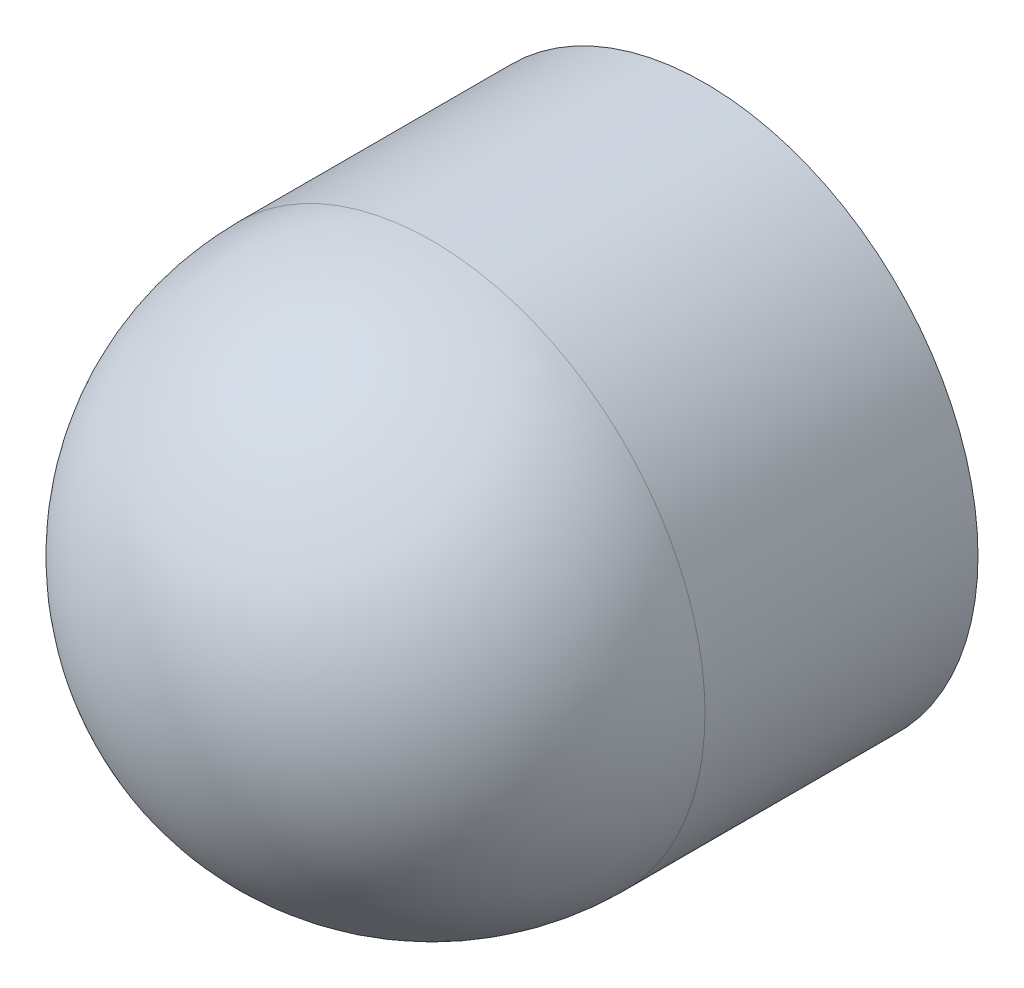
from build123d import *

# Parameters (mm, degrees)
ESQUISSE1_R             = 10
BOSS_EXTRU_1_DEPTH      = 10
D_ME1_FACE_RADIUS       = 10
D_ME1_HEIGHT            = 10
ESQUISSE2_R             = 2.52
ENL_V_MAT_EXTRU_1_DEPTH = 10


with BuildPart() as part:
    # Esquisse1 → Boss.-Extru.1 (new body)
    with BuildSketch(Plane.XY):
        Circle(ESQUISSE1_R)
    extrude(amount=BOSS_EXTRU_1_DEPTH)

    # Dôme1: a dome of height H over a round flat face of radius A is a cap of a sphere of radius (A * A + H * H) / (2 * H)
    d_me1_r = (D_ME1_FACE_RADIUS * D_ME1_FACE_RADIUS + D_ME1_HEIGHT * D_ME1_HEIGHT) / (2 * D_ME1_HEIGHT)
    d_me1_base = Plane((0, 0, 10), z_dir=(0, 0, 1))
    with Locations(d_me1_base.offset(D_ME1_HEIGHT - d_me1_r)):
        d_me1_ball = Sphere(d_me1_r, mode=Mode.PRIVATE)
    add(split(d_me1_ball, bisect_by=d_me1_base, keep=Keep.TOP, mode=Mode.PRIVATE))

    # Esquisse2 → Enlèv. mat.-Extru.1 (cut)
    with BuildSketch(Plane(origin=(0, 0, 0), x_dir=(-1, 0, 0), z_dir=(0, 0, -1))):
        Circle(ESQUISSE2_R)
    extrude(amount=-ENL_V_MAT_EXTRU_1_DEPTH, mode=Mode.SUBTRACT)


solid = part.part
